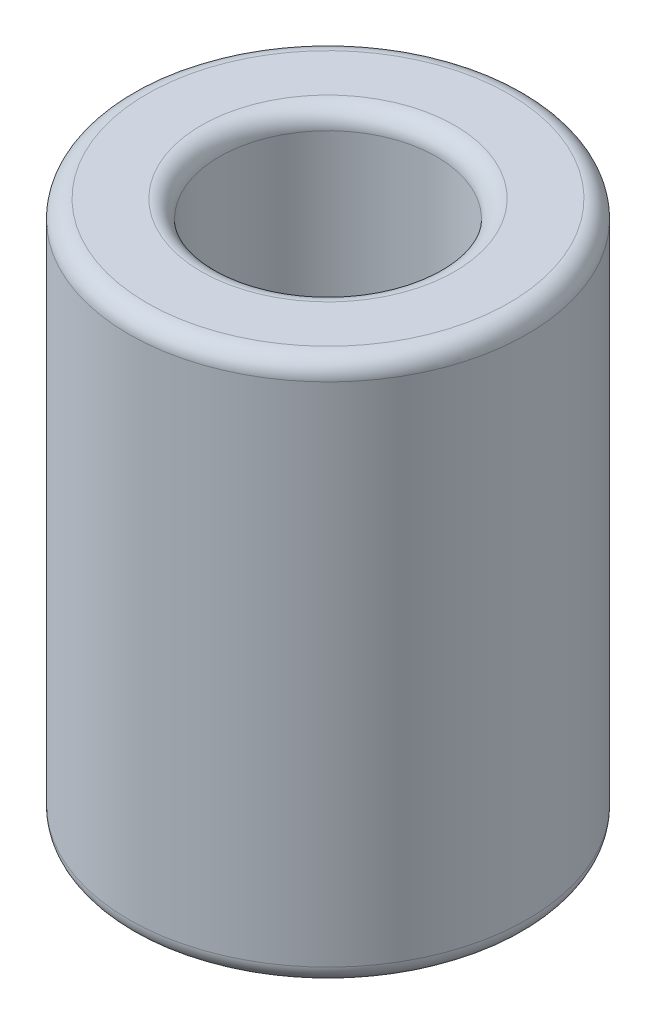
from build123d import *

# Parameters (mm, degrees)
SKETCH1_R           = 11
BOSS_EXTRUDE1_DEPTH = 30
SKETCH2_R           = 6
CUT_EXTRUDE1_DEPTH  = 34.793490497
FILLET2_R           = 1


with BuildPart() as part:
    # Sketch1 → Boss-Extrude1 (new body)
    with BuildSketch(Plane(origin=(0, 0, 0), x_dir=(1, 0, 0), z_dir=(0, 1, 0))):
        with Locations(Location((0, 0, 0), (0, 0, 270))):
            Circle(SKETCH1_R)
    extrude(amount=BOSS_EXTRUDE1_DEPTH)

    # Sketch2 → Cut-Extrude1 (cut, through all)
    with BuildSketch(Plane(origin=(0, 30, 0), x_dir=(1, 0, 0), z_dir=(0, 1, 0))):
        with Locations(Location((0, 0, 0), (0, 0, 270))):
            Circle(SKETCH2_R)
    extrude(amount=-CUT_EXTRUDE1_DEPTH, mode=Mode.SUBTRACT)

    # Fillet2
    fillet2_edges = [part.edges().sort_by_distance(p)[0] for p in [
        (0, 0, -11),
        (0, 30, -11),
        (0, 0, -6),
        (0, 30, -6),
    ]]
    fillet(fillet2_edges, radius=FILLET2_R)


solid = part.part
